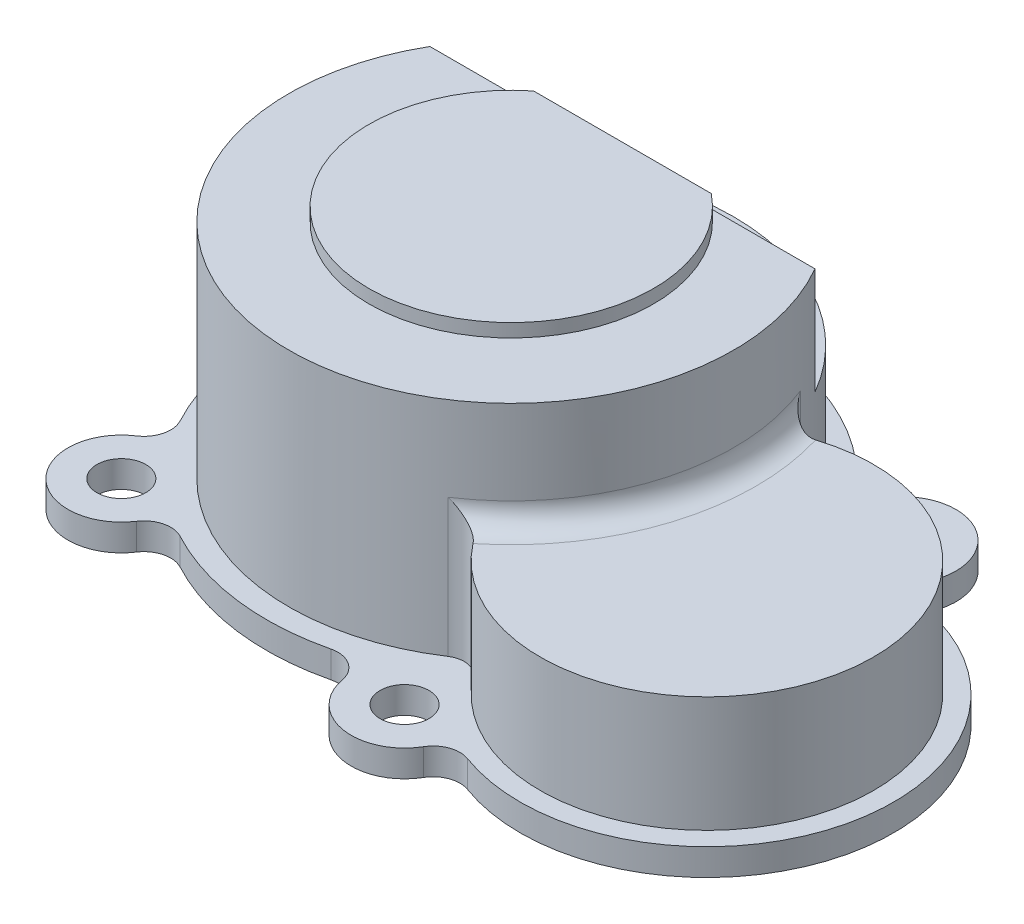
from build123d import *

# Parameters (mm, degrees)
BOSS_EXTRUDE1_DEPTH = 6
SKETCH2_R           = 5.5
CUT_EXTRUDE1_DEPTH  = 6
SKETCH3_R           = 50
BOSS_EXTRUDE2_DEPTH = 50
SKETCH4_R           = 37.5
BOSS_EXTRUDE3_DEPTH = 26
SKETCH5_R           = 32
BOSS_EXTRUDE4_DEPTH = 3
FILLET2_R           = 6
FILLET3_R           = 6
FILLET4_R           = 5
CUT_EXTRUDE2_START  = -27
CUT_EXTRUDE2_DEPTH  = 27


with BuildPart() as part:
    # Sketch1 → Boss-Extrude1 (new body)
    with BuildSketch(Plane(origin=(0, 0, 0), x_dir=(1, 0, 0), z_dir=(0, 1, 0))):
        with BuildLine():
            ThreePointArc((21.211789327, -50.745048956), (28.860136885, -67.581936782), (43.965179902, -56.913493246))
            ThreePointArc((43.965179902, -56.913493246), (104.875389558, -29.654145663), (62.597817721, 21.976587342))
            ThreePointArc((62.597817721, 21.976587342), (62.107138398, 42.329707672), (44.037643352, 32.949749135))
            ThreePointArc((44.037643352, 32.949749135), (8.49481412, 54.340023308), (-31.880473469, 44.817802394))
            ThreePointArc((-31.880473469, 44.817802394), (-52.325901808, 52.325901808), (-44.817802394, 31.880473469))
            ThreePointArc((-44.817802394, 31.880473469), (-55, 0), (-44.817802394, -31.880473469))
            ThreePointArc((-44.817802394, -31.880473469), (-52.325901808, -52.325901808), (-31.880473469, -44.817802394))
            ThreePointArc((-31.880473469, -44.817802394), (-6.102316632, -54.660421986), (21.211789327, -50.745048956))
        make_face()
    extrude(amount=BOSS_EXTRUDE1_DEPTH)

    # Sketch2 → Cut-Extrude1 (cut)
    with BuildSketch(Plane(origin=(0, 6, 0), x_dir=(1, 0, 0), z_dir=(0, 1, 0))):
        with Locations(Location((56, 32, 0), (0, 0, 270))):
            Circle(SKETCH2_R)
        with Locations(Location((-43.840620434, 43.840620434, 0), (0, 0, 270))):
            Circle(SKETCH2_R)
        with Locations(Location((-43.840620434, -43.840620434, 0), (0, 0, 270))):
            Circle(SKETCH2_R)
        with Locations(Location((32, -56, 0), (0, 0, 270))):
            Circle(SKETCH2_R)
    extrude(amount=-CUT_EXTRUDE1_DEPTH, mode=Mode.SUBTRACT)

    # Sketch3 → Boss-Extrude2 (add)
    with BuildSketch(Plane(origin=(0, 6, 0), x_dir=(1, 0, 0), z_dir=(0, 1, 0))):
        with Locations(Location((0, 0, 0), (0, 0, 270))):
            Circle(SKETCH3_R)
    extrude(amount=BOSS_EXTRUDE2_DEPTH)

    # Sketch4 → Boss-Extrude3 (add)
    with BuildSketch(Plane(origin=(0, 6, 0), x_dir=(1, 0, 0), z_dir=(0, 1, 0))):
        with Locations((64, -20)):
            Circle(SKETCH4_R)
    extrude(amount=BOSS_EXTRUDE3_DEPTH)

    # Sketch5 → Boss-Extrude4 (add)
    with BuildSketch(Plane(origin=(0, 56, 0), x_dir=(1, 0, 0), z_dir=(0, 1, 0))):
        with Locations(Location((0, 0, 0), (0, 0, 270))):
            Circle(SKETCH5_R)
    extrude(amount=BOSS_EXTRUDE4_DEPTH)

    # Fillet2
    fillet2_edges = [part.edges().sort_by_distance(p)[0] for p in [
        (44.037643352, 3, -32.949749135),
    ]]
    fillet(fillet2_edges, radius=FILLET2_R)

    # Fillet3
    fillet3_edges = [part.edges().sort_by_distance(p)[0] for p in [
        (21.211789327, 3, 50.745048956),
        (-31.880473469, 3, 44.817802394),
        (-44.817802394, 3, 31.880473469),
        (-44.817802394, 3, -31.880473469),
        (-31.880473469, 3, -44.817802394),
        (62.597817721, 3, -21.976587342),
        (43.965179902, 3, 56.913493246),
    ]]
    fillet(fillet3_edges, radius=FILLET3_R)

    # Fillet4
    fillet4_edges = [part.edges().sort_by_distance(p)[0] for p in [
        (47.723998902, 32, 14.913749657),
        (48.021654026, 19, -13.925542883),
        (31.547740992, 19, 38.790978827),
    ]]
    fillet(fillet4_edges, radius=FILLET4_R)

    # Sketch6 → Cut-Extrude2 (cut)
    with BuildSketch(Plane(origin=(0, 59, 0), x_dir=(1, 0, 0), z_dir=(0, 1, 0)).offset(CUT_EXTRUDE2_START)):
        with BuildLine():
            Line((0, 25), (43.301270189, 25))
            ThreePointArc((43.301270189, 25), (0, 50), (-43.301270189, 25))
            Line((-43.301270189, 25), (0, 25))
        make_face()
    extrude(amount=CUT_EXTRUDE2_DEPTH, mode=Mode.SUBTRACT)


solid = part.part
